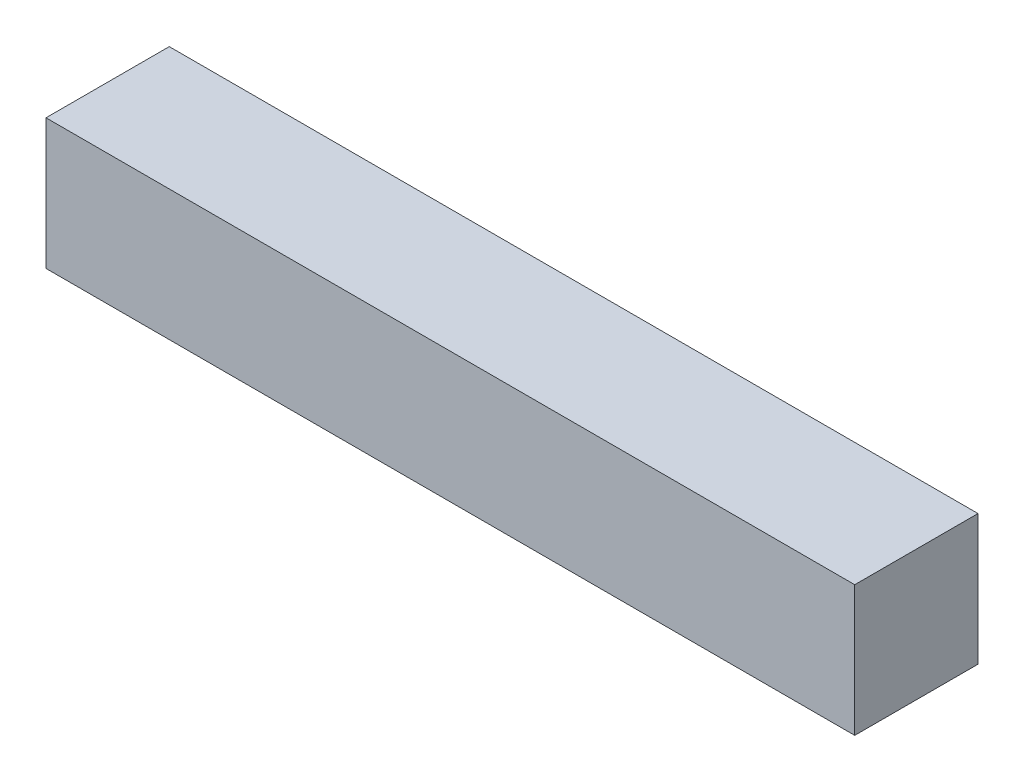
from build123d import *

# Parameters (mm, degrees)
SKETCH_1_W      = 76.212888387
SKETCH_1_H      = 80.685038317
EXTRUDE_1_DEPTH = 500


with BuildPart() as part:
    # 草图1 → 凸台-拉伸1 (new body)
    with BuildSketch(Plane(origin=(0, 0, 0), x_dir=(0, 0, -1), z_dir=(1, 0, 0))):
        with Locations((1.956565594, -0.279509371)):
            Rectangle(SKETCH_1_W, SKETCH_1_H)
    extrude(amount=EXTRUDE_1_DEPTH)


solid = part.part
